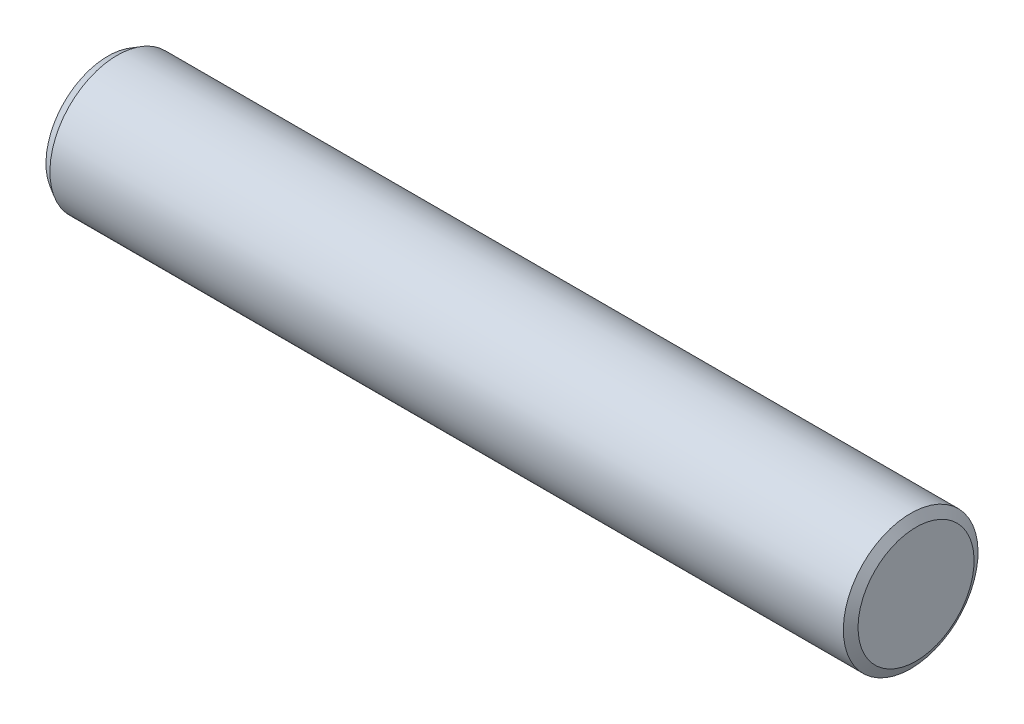
from build123d import *
from OCP.BRepFilletAPI import BRepFilletAPI_MakeChamfer

# Parameters (mm, degrees)
SKETCH1_W      = 30
SKETCH1_H      = 2.5
CHAMFER1_SIZE  = 0.2
CHAMFER1_SIZE2 = 0.346410162


with BuildPart() as part:
    # Sketch1 → Revolve1 (revolve)
    with BuildSketch(Plane.XY):
        with Locations((-15, 1.25)):
            Rectangle(SKETCH1_W, SKETCH1_H)
    revolve(axis=Axis((0, 0, 0), (-1, 0, 0)))

    # Chamfer1: one chamfer whose edges measure the first distance from different faces: ONE call of the kernel's chamfer builder (chamfer() names one face for all edges)
    chamfer1_edges_1 = [part.edges().sort_by_distance(p)[0] for p in [
        (-30, -2.5, 0),
    ]]
    chamfer1_side_1 = [part.faces().sort_by_distance(p)[0] for p in [
        (-30, 0, 0),
    ]]
    chamfer1_edges_2 = [part.edges().sort_by_distance(p)[0] for p in [
        (0, -2.5, 0),
    ]]
    chamfer1_side_2 = [part.faces().sort_by_distance(p)[0] for p in [
        (-15, -2.5, 0),
    ]]
    chamfer1 = BRepFilletAPI_MakeChamfer(part.part.solid().wrapped)
    for e in chamfer1_edges_1:
        chamfer1.Add(CHAMFER1_SIZE, CHAMFER1_SIZE2, e.wrapped, chamfer1_side_1[0].wrapped)  # the first distance lies on this face
    for e in chamfer1_edges_2:
        chamfer1.Add(CHAMFER1_SIZE, CHAMFER1_SIZE2, e.wrapped, chamfer1_side_2[0].wrapped)  # the first distance lies on this face
    add(Compound.cast(chamfer1.Shape()), mode=Mode.REPLACE)


solid = part.part
